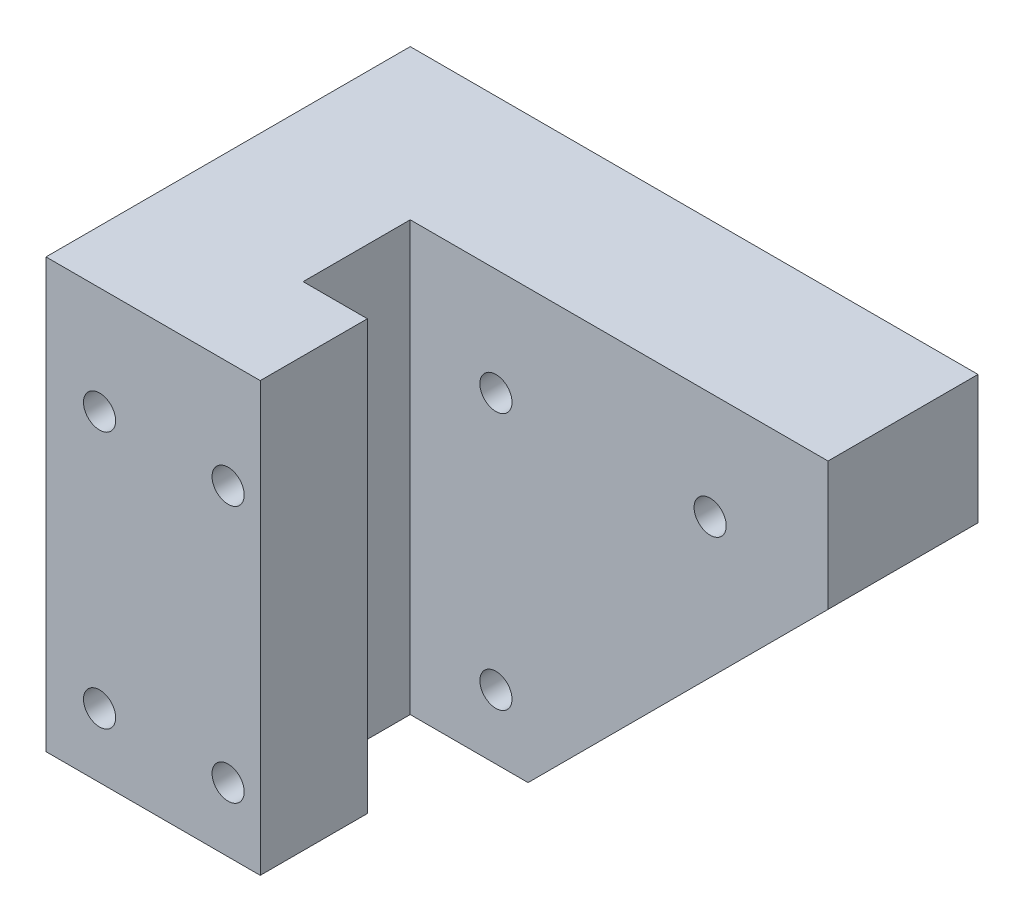
from build123d import *

# Parameters (mm, degrees)
SKETCH_1_W          = 20
SKETCH_1_H          = 40
EXTRUDE_1_DEPTH     = 34
SKETCH_2_R          = 1.5
CUT_EXTRUDE_1_DEPTH = 57.178287621
EXTRUDE_START       = -34
SKETCH_3_W          = 33
SKETCH_3_H          = 40
EXTRUDE_2_DEPTH     = 14
CUT_EXTRUDE_2_DEPTH = 75.598927606
SKETCH_5_R          = 1.5
CUT_EXTRUDE_3_DEPTH = 75.598927606
SKETCH_6_W          = 6
SKETCH_6_H          = 10
CUT_EXTRUDE_4_DEPTH = 75.598927606
SKETCH_7_R          = 1.5
CUT_EXTRUDE_5_DEPTH = 10


with BuildPart() as part:
    # 草图1 → 凸台-拉伸1 (new body)
    with BuildSketch(Plane.XY):
        with Locations((10, 20)):
            Rectangle(SKETCH_1_W, SKETCH_1_H)
    extrude(amount=EXTRUDE_1_DEPTH)

    # 草图2 → 切除-拉伸1 (cut, through all)
    with BuildSketch(Plane.XY.offset(34)):
        with Locations((5, 30)):
            Circle(SKETCH_2_R)
        with Locations((5, 6)):
            Circle(SKETCH_2_R)
    extrude(amount=-CUT_EXTRUDE_1_DEPTH, mode=Mode.SUBTRACT)

    # 草图3 → 凸台-拉伸2 (add)
    with BuildSketch(Plane.XY.offset(34).offset(EXTRUDE_START)):
        with Locations((36.5, 20)):
            Rectangle(SKETCH_3_W, SKETCH_3_H)
    extrude(amount=EXTRUDE_2_DEPTH)

    # 草图4 → 切除-拉伸2 (cut, through all)
    with BuildSketch(Plane(origin=(0, 0, 0), x_dir=(-1, 0, 0), z_dir=(0, 0, -1))):
        Polygon((-25, 0), (-53, 0), (-53, 28), align=None)
    extrude(amount=-CUT_EXTRUDE_2_DEPTH, mode=Mode.SUBTRACT)

    # 草图5 → 切除-拉伸3 (cut, through all)
    with BuildSketch(Plane(origin=(0, 0, 0), x_dir=(-1, 0, 0), z_dir=(0, 0, -1))):
        with Locations((-22, 30)):
            Circle(SKETCH_5_R)
        with Locations((-22, 6)):
            Circle(SKETCH_5_R)
        with Locations((-42, 30)):
            Circle(SKETCH_5_R)
    extrude(amount=-CUT_EXTRUDE_3_DEPTH, mode=Mode.SUBTRACT)

    # 草图6 → 切除-拉伸4 (cut, through all)
    with BuildSketch(Plane.XZ):
        with Locations((17, 19)):
            Rectangle(SKETCH_6_W, SKETCH_6_H)
    extrude(amount=-CUT_EXTRUDE_4_DEPTH, mode=Mode.SUBTRACT)

    # 草图7 → 切除-拉伸5 (cut)
    with BuildSketch(Plane.XY.offset(34)):
        with Locations((17, 30)):
            Circle(SKETCH_7_R)
        with Locations((17, 6)):
            Circle(SKETCH_7_R)
    extrude(amount=-CUT_EXTRUDE_5_DEPTH, mode=Mode.SUBTRACT)


solid = part.part
